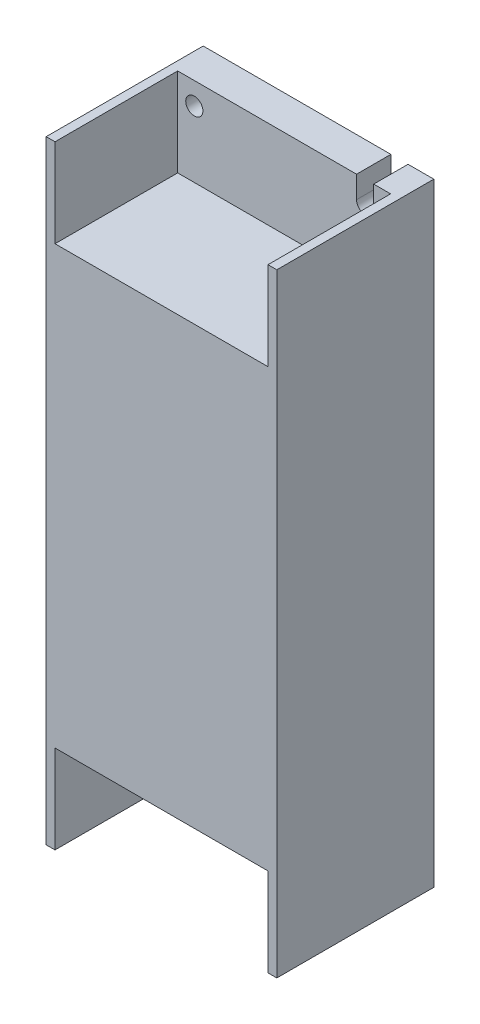
from build123d import *

# Parameters (mm, degrees)
SKETCH_1_W          = 47
SKETCH_1_H          = 125
EXTRUDE_1_DEPTH     = 32
SKETCH_2_W          = 43.4
SKETCH_2_H          = 18
CUT_EXTRUDE_1_DEPTH = 25
SKETCH_4_R          = 1.75
CUT_EXTRUDE_2_DEPTH = 10


with BuildPart() as part:
    # 草图1 → 凸台-拉伸1 (new body)
    with BuildSketch(Plane.XY):
        Rectangle(SKETCH_1_W, SKETCH_1_H)
    extrude(amount=EXTRUDE_1_DEPTH)

    # 草图2 → 切除-拉伸1 (cut)
    with BuildSketch(Plane.XY.offset(32)):
        with Locations((0, 53.5)):
            Rectangle(SKETCH_2_W, SKETCH_2_H)
    cut_extrude_1 = extrude(amount=-CUT_EXTRUDE_1_DEPTH, mode=Mode.SUBTRACT)

    # 草图4 → 切除-拉伸2 (cut)
    with BuildSketch(Plane(origin=(0, 0, 0), x_dir=(-1, 0, 0), z_dir=(0, 0, -1))):
        with Locations((-18.312611664, -58)):
            Circle(SKETCH_4_R)
        with Locations((18.312611664, 58)):
            Circle(SKETCH_4_R)
        with BuildLine():
            Line((14.75, -58), (14.75, -62.5))
            Line((14.75, -62.5), (18.25, -62.5))
            Line((18.25, -62.5), (18.25, -58))
            ThreePointArc((18.25, -58), (16.5, -56.25), (14.75, -58))
        make_face()
        with BuildLine():
            Line((-14.75, 58), (-14.75, 62.5))
            Line((-14.75, 62.5), (-18.25, 62.5))
            Line((-18.25, 62.5), (-18.25, 58))
            ThreePointArc((-18.25, 58), (-16.5, 56.25), (-14.75, 58))
        make_face()
    extrude(amount=-CUT_EXTRUDE_2_DEPTH, mode=Mode.SUBTRACT)

    # 镜向1: 切除-拉伸1 across plane
    add(cut_extrude_1.mirror(Plane.ZX), mode=Mode.SUBTRACT)


solid = part.part
